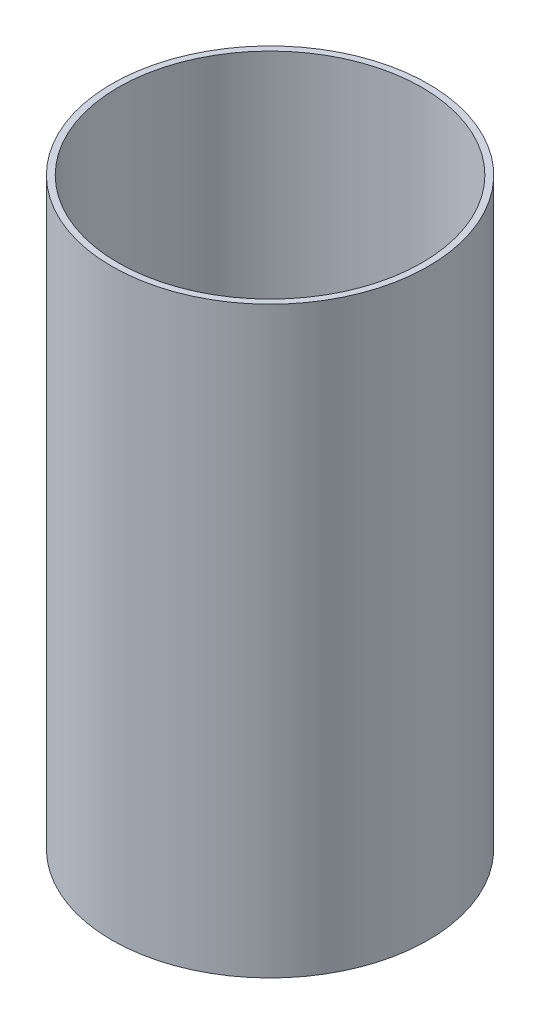
from build123d import *

# Parameters (mm, degrees)
SKETCH1_R           = 37.95
SKETCH1_R_2         = 36.45
BOSS_EXTRUDE1_DEPTH = 140


with BuildPart() as part:
    # Sketch1 → Boss-Extrude1 (new body)
    with BuildSketch(Plane(origin=(0, 0, 0), x_dir=(1, 0, 0), z_dir=(0, 1, 0))):
        with Locations(Location((0, 0, 0), (0, 0, 270))):
            Circle(SKETCH1_R)
        with Locations(Location((0, 0, 0), (0, 0, 270))):
            Circle(SKETCH1_R_2, mode=Mode.SUBTRACT)
    extrude(amount=BOSS_EXTRUDE1_DEPTH)


solid = part.part
